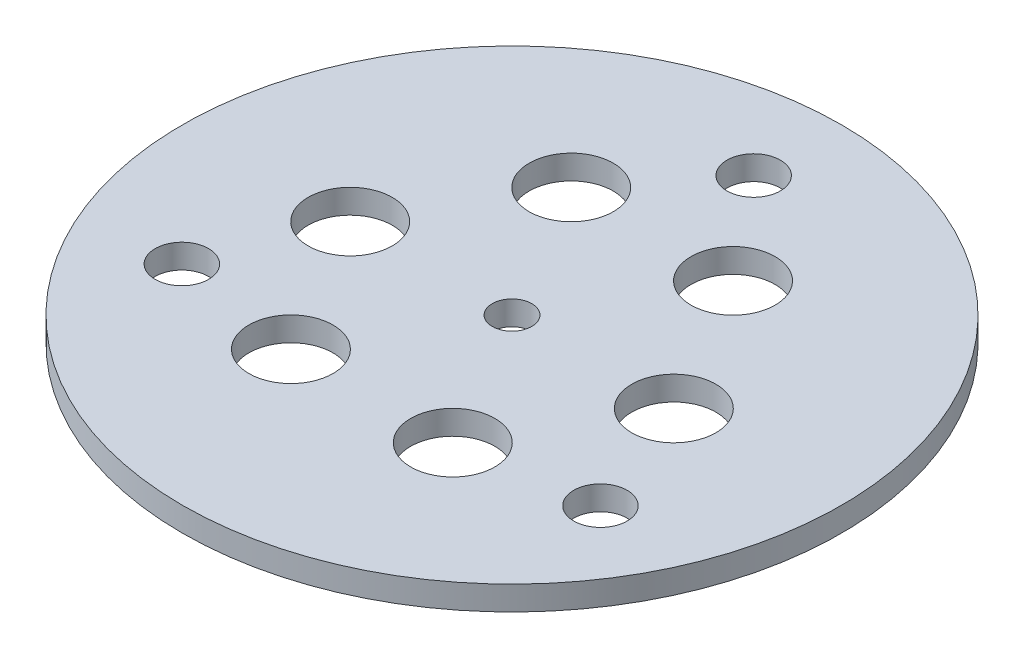
from build123d import *

# Parameters (mm, degrees)
SKETCH4_R           = 75
SKETCH4_R_2         = 9.575
SKETCH4_R_3         = 4.5
SKETCH4_R_4         = 6.075
BOSS_EXTRUDE1_DEPTH = 5.5


with BuildPart() as part:
    # Sketch4 → Boss-Extrude1 (new body)
    with BuildSketch(Plane(origin=(0, 0, 0), x_dir=(1, 0, 0), z_dir=(0, 1, 0))):
        with Locations(Location((0, 0, 0), (0, 0, 270))):
            Circle(SKETCH4_R)
        with Locations(Location((-36.827392181, 0, 0), (0, 0, 270))):
            Circle(SKETCH4_R_2, mode=Mode.SUBTRACT)
        with Locations(Location((-18.413696091, 31.893457184, 0), (0, 0, 270))):
            Circle(SKETCH4_R_2, mode=Mode.SUBTRACT)
        with Locations(Location((18.413696091, 31.893457184, 0), (0, 0, 270))):
            Circle(SKETCH4_R_2, mode=Mode.SUBTRACT)
        with Locations(Location((36.827392181, 0, 0), (0, 0, 270))):
            Circle(SKETCH4_R_2, mode=Mode.SUBTRACT)
        with Locations(Location((18.413696091, -31.893457184, 0), (0, 0, 270))):
            Circle(SKETCH4_R_2, mode=Mode.SUBTRACT)
        with Locations(Location((-18.413696091, -31.893457184, 0), (0, 0, 270))):
            Circle(SKETCH4_R_2, mode=Mode.SUBTRACT)
        with Locations(Location((0, 0, 0), (0, 0, 270))):
            Circle(SKETCH4_R_3, mode=Mode.SUBTRACT)
        with Locations(Location((0, 55, 0), (0, 0, 270))):
            Circle(SKETCH4_R_4, mode=Mode.SUBTRACT)
        with Locations(Location((47.631397208, -27.5, 0), (0, 0, 270))):
            Circle(SKETCH4_R_4, mode=Mode.SUBTRACT)
        with Locations(Location((-47.631397208, -27.5, 0), (0, 0, 270))):
            Circle(SKETCH4_R_4, mode=Mode.SUBTRACT)
    extrude(amount=BOSS_EXTRUDE1_DEPTH)


solid = part.part
